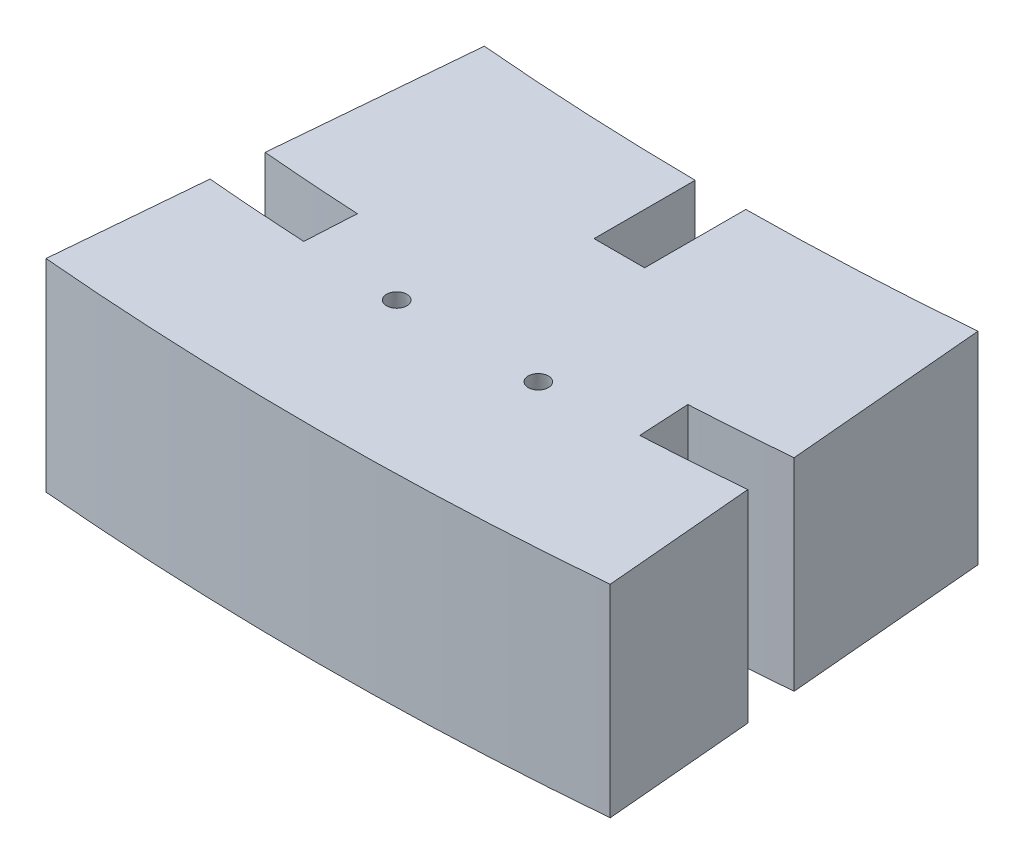
from build123d import *

# Parameters (mm, degrees)
EXTRUDE_1_DEPTH     = 100
CUT_EXTRUDE_2_DEPTH = 1610.175588972
CUT_EXTRUDE_3_DEPTH = 1610.175588972


with BuildPart() as part:
    # 草图3 → 凸台-拉伸1 (new body)
    with BuildSketch(Plane(origin=(0, 0, 0), x_dir=(1, 0, 0), z_dir=(0, 1, 0))):
        with BuildLine():
            Line((-139.449188396, -1593.911516947), (-122.018039847, -1394.672577328))
            ThreePointArc((-122.018039847, -1394.672577328), (0, -1400), (122.018039847, -1394.672577328))
            Line((122.018039847, -1394.672577328), (139.449188396, -1593.911516947))
            ThreePointArc((139.449188396, -1593.911516947), (0, -1600), (-139.449188396, -1593.911516947))
        make_face()
    extrude(amount=EXTRUDE_1_DEPTH)

    # 草图6 → 切除-拉伸2 (cut, through all)
    with BuildSketch(Plane(origin=(0, 100, 0), x_dir=(1, 0, 0), z_dir=(0, 1, 0))):
        Polygon((-12.5, -1399.944195316), (12.5, -1399.944195316), (12.5, -1449.944195316), (0, -1449.944195316), (-12.5, -1449.944195316), align=None)
    extrude(amount=-CUT_EXTRUDE_2_DEPTH, mode=Mode.SUBTRACT)

    # 草图8 → 切除-旋转1 (revolve, cut)
    with BuildSketch(Plane(origin=(-35, 0, 0), x_dir=(0, 0, -1), z_dir=(1, 0, 0)), mode=Mode.PRIVATE) as cut_revolve_1_sk:
        Polygon((-1525, 100), (-1530, 100), (-1538.682408883, 50.759612349), (-1538.682408883, 0), (-1525, 0), align=None)
    cut_revolve_1 = revolve(cut_revolve_1_sk.sketch.rotate(Axis((-35, 0, 1525), (0, 1, 0)), 180), axis=Axis((-35, 0, 1525), (0, 1, 0)), mode=Mode.SUBTRACT)

    # 镜向1: 切除-旋转1 across plane
    add(cut_revolve_1.mirror(Plane.ZY), mode=Mode.SUBTRACT)

    # 草图9 → 切除-拉伸3 (cut, through all)
    with BuildSketch(Plane(origin=(0, 100, 0), x_dir=(1, 0, 0), z_dir=(0, 1, 0))):
        with BuildLine():
            Line((81.67512146, -1497.774740919), (83.044783982, -1522.891886672))
            ThreePointArc((83.044783982, -1522.891886672), (107.999891135, -1521.325789617), (132.925969989, -1519.350789364))
            Line((132.925969989, -1519.350789364), (130.733614121, -1494.292047138))
            ThreePointArc((130.733614121, -1494.292047138), (106.218642558, -1496.234473595), (81.67512146, -1497.774740919))
        make_face()
        with BuildLine():
            Line((-83.044783982, -1522.891886672), (-81.67512146, -1497.774740919))
            ThreePointArc((-81.67512146, -1497.774740919), (-106.218642558, -1496.234473595), (-130.733614121, -1494.292047138))
            Line((-130.733614121, -1494.292047138), (-132.925969989, -1519.350789364))
            ThreePointArc((-132.925969989, -1519.350789364), (-107.999891135, -1521.325789617), (-83.044783982, -1522.891886672))
        make_face()
    extrude(amount=-CUT_EXTRUDE_3_DEPTH, mode=Mode.SUBTRACT)


solid = part.part
